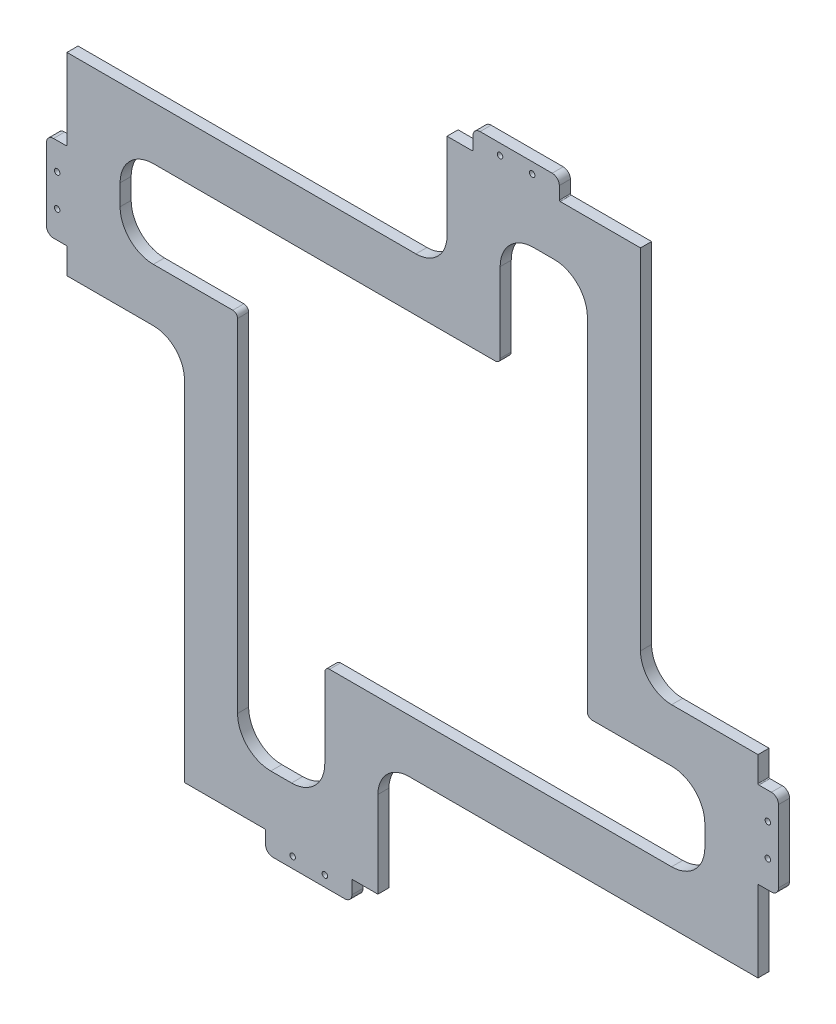
from build123d import *

# Parameters (mm, degrees)
SKETCH2_R          = 0.3937
EXTRUDE1_DEPTH     = 0.7874
CIRPATTERN1_COUNT  = 4
CUT_EXTRUDE1_DEPTH = 2.54


with BuildPart() as part:
    # Sketch2 → Extrude1 (new, symmetric)
    with BuildSketch(Plane.XY):
        with BuildLine():
            Line((-19.657568, 24.57196), (11.7945408, 24.57196))
            ThreePointArc((11.7945408, 24.57196), (12.489540782, 24.859838418), (12.7774192, 25.5548384))
            Line((12.7774192, 25.5548384), (12.7774192, 36.85794))
            ThreePointArc((12.7774192, 36.85794), (14.072872082, 39.985439918), (17.200372, 41.2808928))
            Line((17.200372, 41.2808928), (20.1490072, 41.2808928))
            ThreePointArc((20.1490072, 41.2808928), (23.276507118, 39.985439918), (24.57196, 36.85794))
            Line((24.57196, 36.85794), (24.57196, 9.828784))
            Line((24.57196, 9.828784), (32.4349872, 9.828784))
            Line((32.4349872, 9.828784), (32.4349872, 49.14392))
            Line((32.4349872, 49.14392), (21.013166, 49.14392))
            ThreePointArc((21.013166, 49.14392), (20.923363439, 49.181117439), (20.886166, 49.27092))
            Line((20.886166, 49.27092), (20.886166, 51.04892))
            ThreePointArc((20.886166, 51.04892), (20.58858649, 51.76734049), (19.870166, 52.06492))
            Line((19.870166, 52.06492), (9.616186, 52.06492))
            ThreePointArc((9.616186, 52.06492), (8.89776551, 51.76734049), (8.600186, 51.04892))
            Line((8.600186, 51.04892), (8.600186, 49.27092))
            ThreePointArc((8.600186, 49.27092), (8.562988561, 49.181117439), (8.473186, 49.14392))
            Line((8.473186, 49.14392), (4.914392, 49.14392))
            Line((4.914392, 49.14392), (4.914392, 36.85794))
            ThreePointArc((4.914392, 36.85794), (3.618939118, 33.730440082), (0.4914392, 32.4349872))
            Line((0.4914392, 32.4349872), (-19.657568, 32.4349872))
            Line((-19.657568, 32.4349872), (-19.657568, 24.57196))
        make_face()
        with Locations((12.457176, 50.54092)):
            Circle(SKETCH2_R, mode=Mode.SUBTRACT)
        with Locations((17.029176, 50.54092)):
            Circle(SKETCH2_R, mode=Mode.SUBTRACT)
    extrude1 = extrude(amount=EXTRUDE1_DEPTH, both=True)

    # CirPattern1: Extrude1 ×4 about axis
    cirpattern1_axis = Axis((0, 0, -69.733664692), (0, 0, 1))
    for i in range(1, CIRPATTERN1_COUNT):
        add(extrude1.rotate(cirpattern1_axis, i * 360 / CIRPATTERN1_COUNT))

    # Sketch3 → Cut-Extrude1 (cut)
    with BuildSketch(Plane.XY.offset(0.7874)):
        with BuildLine():
            Line((-41.5856928, 20.1490072), (-41.5856928, 17.200372))
            ThreePointArc((-41.5856928, 17.200372), (-40.200966065, 13.857345935), (-36.85794, 12.4726192))
            Line((-36.85794, 12.4726192), (-25.5548384, 12.4726192))
            ThreePointArc((-25.5548384, 12.4726192), (-25.075364565, 12.274014635), (-24.87676, 11.7945408))
            Line((-24.87676, 11.7945408), (-24.87676, -36.85794))
            ThreePointArc((-24.87676, -36.85794), (-23.492033265, -40.200966065), (-20.1490072, -41.5856928))
            Line((-20.1490072, -41.5856928), (-17.200372, -41.5856928))
            ThreePointArc((-17.200372, -41.5856928), (-13.857345935, -40.200966065), (-12.4726192, -36.85794))
            Line((-12.4726192, -36.85794), (-12.4726192, -25.5548384))
            ThreePointArc((-12.4726192, -25.5548384), (-12.274014635, -25.075364565), (-11.7945408, -24.87676))
            Line((-11.7945408, -24.87676), (36.85794, -24.87676))
            ThreePointArc((36.85794, -24.87676), (40.200966065, -23.492033265), (41.5856928, -20.1490072))
            Line((41.5856928, -20.1490072), (41.5856928, -17.200372))
            ThreePointArc((41.5856928, -17.200372), (40.200966065, -13.857345935), (36.85794, -12.4726192))
            Line((36.85794, -12.4726192), (25.5548384, -12.4726192))
            ThreePointArc((25.5548384, -12.4726192), (25.075364565, -12.274014635), (24.87676, -11.7945408))
            Line((24.87676, -11.7945408), (24.87676, 36.85794))
            ThreePointArc((24.87676, 36.85794), (23.492033265, 40.200966065), (20.1490072, 41.5856928))
            Line((20.1490072, 41.5856928), (17.200372, 41.5856928))
            ThreePointArc((17.200372, 41.5856928), (13.857345935, 40.200966065), (12.4726192, 36.85794))
            Line((12.4726192, 36.85794), (12.4726192, 25.5548384))
            ThreePointArc((12.4726192, 25.5548384), (12.274014635, 25.075364565), (11.7945408, 24.87676))
            Line((11.7945408, 24.87676), (-36.85794, 24.87676))
            ThreePointArc((-36.85794, 24.87676), (-40.200966065, 23.492033265), (-41.5856928, 20.1490072))
        make_face()
    extrude(amount=-CUT_EXTRUDE1_DEPTH, mode=Mode.SUBTRACT)


solid = part.part
